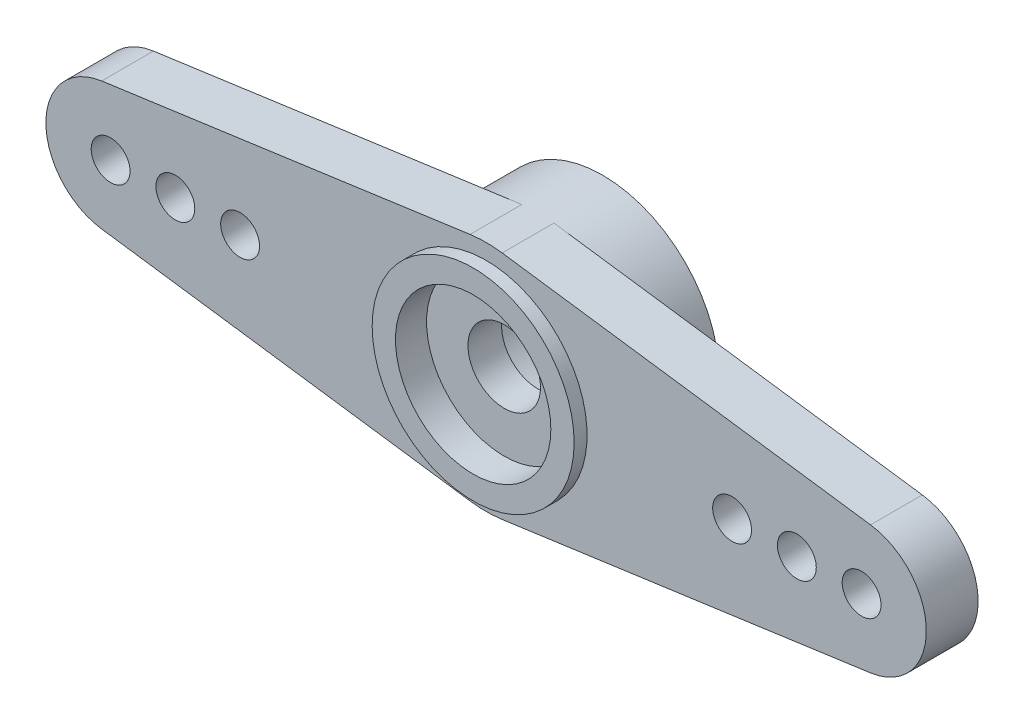
from build123d import *
from build123d.topology import SkipClean

# Parameters (mm, degrees)
ESQUISSE1_R             = 1.4
ESQUISSE1_R_2           = 0.75
BOSS_EXTRU_1_DEPTH      = 2
ESQUISSE2_R             = 3.9
ESQUISSE2_R_2           = 3
BOSS_EXTRU_2_DEPTH      = 0.5
ENL_V_START             = -1.2
ESQUISSE3_R             = 3
ENL_V_MAT_EXTRU_1_DEPTH = 1.2
BOSS_EXTRU_3_START      = 2.5
ESQUISSE4_R             = 4.5
ESQUISSE4_R_2           = 2.75
BOSS_EXTRU_3_DEPTH      = 2.5


with BuildPart() as part:
    # Esquisse1 → Boss.-Extru.1 (new body)
    with BuildSketch(Plane.XY):
        with BuildLine():
            Line((-0.620689655, 4.45698826), (-14.844827586, 2.476104589))
            ThreePointArc((-14.844827586, 2.476104589), (-17, 0), (-14.844827586, -2.476104589))
            Line((-14.844827586, -2.476104589), (-0.620689655, -4.45698826))
            ThreePointArc((-0.620689655, -4.45698826), (0, -4.5), (0.620689655, -4.45698826))
            Line((0.620689655, -4.45698826), (14.844827586, -2.476104589))
            ThreePointArc((14.844827586, -2.476104589), (17, 0), (14.844827586, 2.476104589))
            Line((14.844827586, 2.476104589), (0.620689655, 4.45698826))
            ThreePointArc((0.620689655, 4.45698826), (0, 4.5), (-0.620689655, 4.45698826))
        make_face()
        Circle(ESQUISSE1_R, mode=Mode.SUBTRACT)
        with Locations((14.5, 0)):
            Circle(ESQUISSE1_R_2, mode=Mode.SUBTRACT)
        with Locations((-14.5, 0)):
            Circle(ESQUISSE1_R_2, mode=Mode.SUBTRACT)
        with Locations((-12, 0)):
            Circle(ESQUISSE1_R_2, mode=Mode.SUBTRACT)
        with Locations((-9.5, 0)):
            Circle(ESQUISSE1_R_2, mode=Mode.SUBTRACT)
        with Locations((9.5, 0)):
            Circle(ESQUISSE1_R_2, mode=Mode.SUBTRACT)
        with Locations((12, 0)):
            Circle(ESQUISSE1_R_2, mode=Mode.SUBTRACT)
    extrude(amount=BOSS_EXTRU_1_DEPTH)

    # Esquisse2 → Boss.-Extru.2 (add)
    with BuildSketch(Plane.XY.offset(2)):
        with Locations(Location((0, 0, 0), (0, 0, 180))):
            Circle(ESQUISSE2_R)
        Circle(ESQUISSE2_R_2, mode=Mode.SUBTRACT)
    extrude(amount=BOSS_EXTRU_2_DEPTH)

    # Esquisse3 → Enlèv. mat.-Extru.1 (cut)
    with BuildSketch(Plane.XY.offset(2.5).offset(ENL_V_START)):
        Circle(ESQUISSE3_R)
    extrude(amount=ENL_V_MAT_EXTRU_1_DEPTH, mode=Mode.SUBTRACT)

    # Esquisse4 → Boss.-Extru.3 (add)
    with SkipClean():  # the faces are left unmerged after this step: merging them gives an invalid solid
        with BuildSketch(Plane(origin=(0, 0, 0), x_dir=(-1, 0, 0), z_dir=(0, 0, -1)).offset(BOSS_EXTRU_3_START)):
            Circle(ESQUISSE4_R)
            Circle(ESQUISSE4_R_2, mode=Mode.SUBTRACT)
        extrude(amount=-BOSS_EXTRU_3_DEPTH)


solid = part.part
